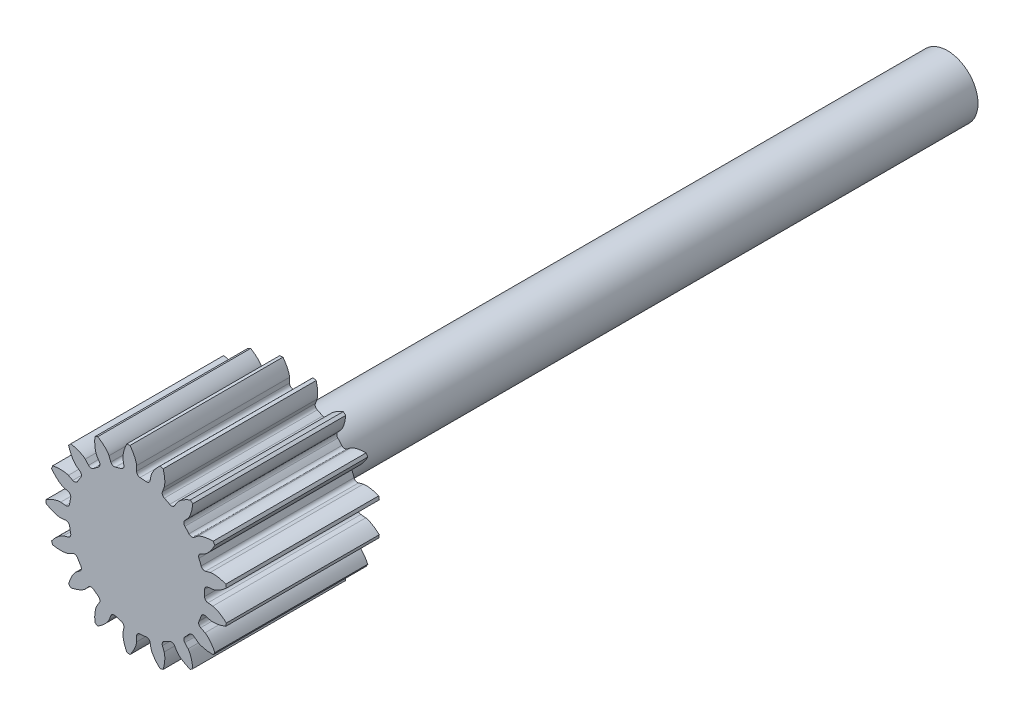
from build123d import *

# Parameters (mm, degrees)
BLANK_SKETCH_R      = 11.875
BLANK_DEPTH         = 20
TOOTH_SPACE_DEPTH   = 27.11572802
TEETH_COUNT         = 17
BORE_DEPTH          = 27.100742332
BORE_DEPTH_BACK     = 27.100742332
BORE_SKETCH_R       = 4
BOSS_EXTRUDE1_START = -106
SKETCH1_R           = 4
BOSS_EXTRUDE1_DEPTH = 106


with BuildPart() as part:
    # Blank Sketch → Blank (new body)
    with BuildSketch(Plane.XY):
        Circle(BLANK_SKETCH_R)
    extrude(amount=BLANK_DEPTH)

    # Tooth Space Sketch → Tooth Space (cut, symmetric)
    with BuildSketch(Plane.XY):
        with BuildLine():
            Line((9.939079093, 0.948492097), (9.295694704, 0.887093551))
            ThreePointArc((9.295694704, 0.887093551), (8.98235795, 0.725899492), (8.866285625, 0.393197431))
            ThreePointArc((8.866285625, 0.393197431), (8.875, 0), (8.866285625, -0.393197431))
            ThreePointArc((8.866285625, -0.393197431), (8.98235795, -0.725899492), (9.295694704, -0.887093551))
            Line((9.295694704, -0.887093551), (9.939079093, -0.948492097))
            add(Edge.make_bspline(
                [(9.939079093, -0.948492097), (9.944419956, -0.949099255), (9.959363538, -0.951100483), (9.987461284, -0.956060515), (10.033024977, -0.965815194), (10.090612537, -0.980674949), (10.164414462, -1.002652043), (10.250457009, -1.032080202), (10.343964765, -1.068095975), (10.444451681, -1.11120542), (10.543514859, -1.15765376), (10.641151163, -1.207155784), (10.737293163, -1.259303994), (10.852346672, -1.325781398), (10.988299107, -1.410072048), (11.14406597, -1.515140112), (11.316856551, -1.641938971), (11.488524989, -1.779131562), (11.653706097, -1.920614485), (11.816027404, -2.070803406), (11.969819819, -2.2212394), (12.124556639, -2.38463298), (12.26486155, -2.539111634), (12.416223734, -2.71980126), (12.536695511, -2.867871874), (12.656096039, -3.026982739), (12.713455505, -3.105320734), (12.742448933, -3.145730469)],
                knots=[0, 0, 0, 0, 0, 0.005376748, 0.015083688, 0.02853182, 0.046610139, 0.064854849, 0.092110525, 0.119476176, 0.146842495, 0.174208854, 0.201574955, 0.228941013, 0.256307345, 0.307035032, 0.361767351, 0.41649966, 0.471231936, 0.525964282, 0.580696615, 0.635428982, 0.690161387, 0.744893688, 0.799626082, 0.854358408, 0.909090915, 0.909090915, 0.909090915, 0.909090915, 0.909090915], degree=4))
            Line((12.742448933, -3.145730469), (12.742448933, 3.145730469))
            add(Edge.make_bspline(
                [(9.939079093, 0.948492097), (9.944419956, 0.949099255), (9.959363538, 0.951100483), (9.987461284, 0.956060515), (10.033024977, 0.965815194), (10.090612537, 0.980674949), (10.164414462, 1.002652043), (10.250457009, 1.032080202), (10.343964765, 1.068095975), (10.444451681, 1.11120542), (10.543514859, 1.15765376), (10.641151163, 1.207155784), (10.737293163, 1.259303994), (10.852346672, 1.325781398), (10.988299107, 1.410072048), (11.14406597, 1.515140112), (11.316856551, 1.641938971), (11.488524989, 1.779131562), (11.653706097, 1.920614485), (11.816027404, 2.070803406), (11.969819819, 2.2212394), (12.124556639, 2.38463298), (12.26486155, 2.539111634), (12.416223734, 2.71980126), (12.536695511, 2.867871874), (12.656096039, 3.026982739), (12.713455505, 3.105320734), (12.742448933, 3.145730469)],
                knots=[0, 0, 0, 0, 0, 0.005376748, 0.015083688, 0.02853182, 0.046610139, 0.064854849, 0.092110525, 0.119476176, 0.146842495, 0.174208854, 0.201574955, 0.228941013, 0.256307345, 0.307035032, 0.361767351, 0.41649966, 0.471231936, 0.525964282, 0.580696615, 0.635428982, 0.690161387, 0.744893688, 0.799626082, 0.854358408, 0.909090915, 0.909090915, 0.909090915, 0.909090915, 0.909090915], degree=4))
        make_face()
    tooth_space = extrude(amount=TOOTH_SPACE_DEPTH, both=True, mode=Mode.SUBTRACT)

    # Teeth: Tooth Space ×17 about axis
    teeth_axis = Axis((0, 0, -0.25007105), (0, 0, 1))
    for i in range(1, TEETH_COUNT):
        add(tooth_space.rotate(teeth_axis, i * 360 / TEETH_COUNT), mode=Mode.SUBTRACT)

    # Bore Sketch → Bore (cut, two sides: drawn at the far end of the back side and taken through both)
    with BuildSketch(Plane.XY.offset(-BORE_DEPTH_BACK)):
        Circle(BORE_SKETCH_R)
    extrude(amount=BORE_DEPTH + BORE_DEPTH_BACK, mode=Mode.SUBTRACT)

    # Sketch1 → Boss-Extrude1 (add)
    with BuildSketch(Plane.XY.offset(20).offset(BOSS_EXTRUDE1_START)):
        Circle(SKETCH1_R)
    extrude(amount=BOSS_EXTRUDE1_DEPTH)


solid = part.part
